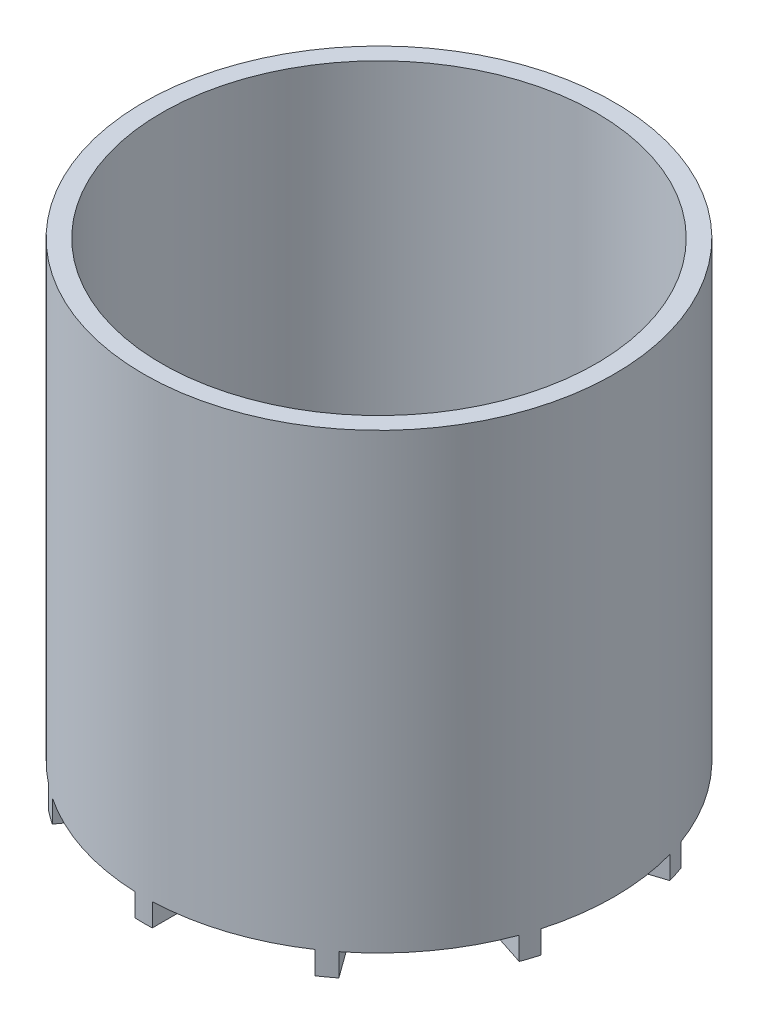
from build123d import *

# Parameters (mm, degrees)
SKETCH1_R               = 38.1
BOSS_EXTRUDE1_DEPTH     = 76.2
SHELL2_T                = 3.175
SKETCH2_W               = 3
SKETCH2_H               = 82.55
BOSS_EXTRUDE2_DEPTH     = 4
CUT_EXTRUDE1_DEPTH      = 99.527366122
CUT_EXTRUDE1_DEPTH_BACK = 99.527366122
SKETCH3_R               = 61.906276858
SKETCH3_R_2             = 41.275


with BuildPart() as part:
    # Sketch1 → Boss-Extrude1 (new body)
    with BuildSketch(Plane(origin=(0, 0, 0), x_dir=(1, 0, 0), z_dir=(0, 1, 0))):
        Circle(SKETCH1_R)
    extrude(amount=BOSS_EXTRUDE1_DEPTH)

    # Shell2
    shell2_openings = [part.faces().sort_by_distance(p)[0] for p in [
        (0, 76.2, 0),
    ]]
    offset(amount=SHELL2_T, openings=shell2_openings, kind=Kind.INTERSECTION)

    # Sketch2 → Boss-Extrude2 (add)
    with BuildSketch(Plane(origin=(0, -3.175, 0), x_dir=(-1, 0, 0), z_dir=(0, -1, 0))):
        Rectangle(SKETCH2_W, SKETCH2_H)
        Polygon((-23.047310797, -34.273854321), (25.47436178, 32.510498564), (23.047310797, 34.273854321), (-25.47436178, -32.510498564), align=None)
        Polygon((-38.791332219, -14.181261217), (39.718383202, 11.328091668), (38.791332219, 14.181261217), (-39.718383202, -11.328091668), align=None)
        Polygon((-39.718383202, 11.328091668), (38.791332219, -14.181261217), (39.718383202, -11.328091668), (-38.791332219, 14.181261217), align=None)
        Polygon((-25.47436178, 32.510498564), (23.047310797, -34.273854321), (25.47436178, -32.510498564), (-23.047310797, 34.273854321), align=None)
    extrude(amount=BOSS_EXTRUDE2_DEPTH)

    # Sketch3 → Cut-Extrude1 (cut, two sides: drawn at the far end of the back side and taken through both)
    with BuildSketch(Plane.XZ.offset(3.175).offset(-CUT_EXTRUDE1_DEPTH_BACK)):
        Circle(SKETCH3_R)
        Circle(SKETCH3_R_2, mode=Mode.SUBTRACT)
    extrude(amount=CUT_EXTRUDE1_DEPTH + CUT_EXTRUDE1_DEPTH_BACK, mode=Mode.SUBTRACT)


solid = part.part
